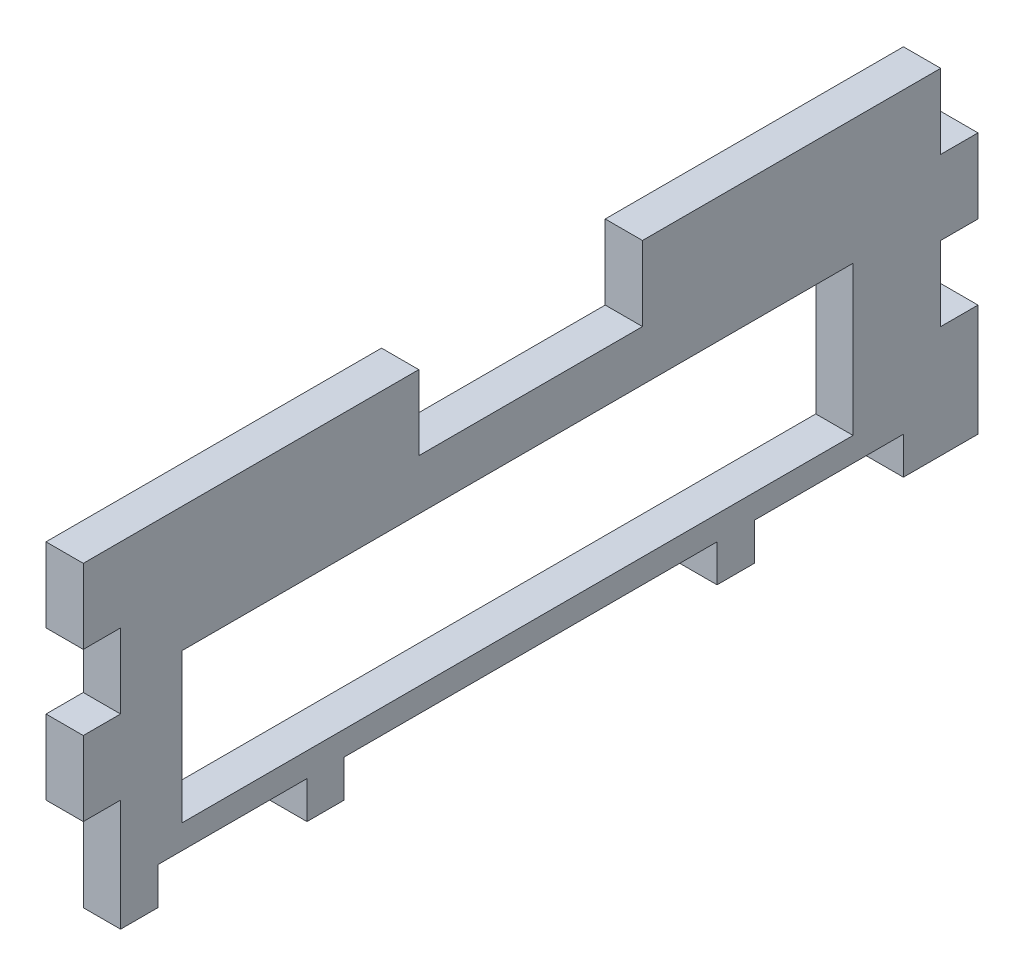
from build123d import *

# Parameters (mm, degrees)
SKETCH1_W           = 114.3
SKETCH1_H           = 25.4
BOSS_EXTRUDE1_DEPTH = 6.35
SKETCH1_4_W         = 6.35
SKETCH1_4_H         = 6.35
BOSS_EXTRUDE2_DEPTH = 6.35


with BuildPart() as part:
    # Sketch1 → Boss-Extrude1 (new body)
    with BuildSketch(Plane(origin=(0, 0, 0), x_dir=(0, 0, -1), z_dir=(1, 0, 0))):
        Polygon((-76.2, 25.4), (-76.2, 12.7), (-69.85, 12.7), (-69.85, 0), (-76.2, 0), (-76.2, -12.7), (-69.85, -12.7), (-69.85, -31.75), (-63.5, -31.75), (-63.5, -25.4), (-38.1, -25.4), (-38.1, -31.75), (-31.75, -31.75), (-31.75, -25.4), (31.75, -25.4), (31.75, -31.75), (38.1, -31.75), (38.1, -25.4), (63.5, -25.4), (63.5, -31.75), (69.85, -31.75), (69.85, -25.4), (76.2, -25.4), (76.2, -12.7), (69.85, -12.7), (69.85, 0), (76.2, 0), (76.2, 12.7), (69.85, 12.7), (69.85, 25.4), (19.05, 25.4), (19.05, 12.7), (-19.05, 12.7), (-19.05, 25.4), align=None)
        with Locations((-2.231703523, -8.592794364)):
            Rectangle(SKETCH1_W, SKETCH1_H, mode=Mode.SUBTRACT)
    extrude(amount=BOSS_EXTRUDE1_DEPTH)

    # Sketch1<4> → Boss-Extrude2 (add)
    with BuildSketch(Plane(origin=(0, 0, 0), x_dir=(0, 0, -1), z_dir=(1, 0, 0))):
        with Locations((73.025, -28.575)):
            Rectangle(SKETCH1_4_W, SKETCH1_4_H)
    extrude(amount=BOSS_EXTRUDE2_DEPTH)


solid = part.part
